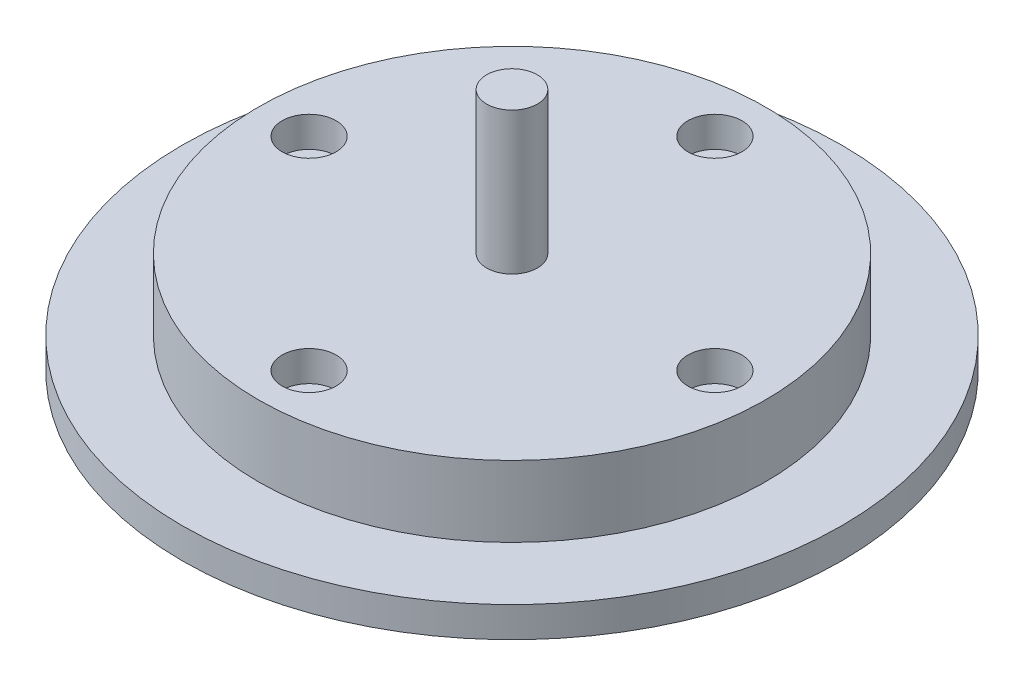
from build123d import *

# Parameters (mm, degrees)
SKETCH1_R           = 25
SKETCH1_R_2         = 1.5
BOSS_EXTRUDE1_DEPTH = 7
CUT_EXTRUDE1_START  = -3
SKETCH2_R           = 2.66
SKETCH2_R_2         = 1.5
CUT_EXTRUDE1_DEPTH  = 3
BOSS_EXTRUDE2_START = -3
SKETCH3_R           = 32.5
SKETCH3_R_2         = 1.5
BOSS_EXTRUDE2_DEPTH = 3
SKETCH4_R           = 2.5
BOSS_EXTRUDE3_DEPTH = 14


with BuildPart() as part:
    # Sketch1 → Boss-Extrude1 (new body)
    with BuildSketch(Plane(origin=(0, 0, 0), x_dir=(1, 0, 0), z_dir=(0, 1, 0))):
        with Locations(Location((0, 0, 0), (0, 0, 270))):
            Circle(SKETCH1_R)
        with Locations(Location((0, 20, 0), (0, 0, 270))):
            Circle(SKETCH1_R_2, mode=Mode.SUBTRACT)
        with Locations(Location((20, 0, 0), (0, 0, 270))):
            Circle(SKETCH1_R_2, mode=Mode.SUBTRACT)
        with Locations(Location((0, -20, 0), (0, 0, 270))):
            Circle(SKETCH1_R_2, mode=Mode.SUBTRACT)
        with Locations(Location((-20, 0, 0), (0, 0, 270))):
            Circle(SKETCH1_R_2, mode=Mode.SUBTRACT)
    extrude(amount=BOSS_EXTRUDE1_DEPTH)

    # Sketch2 → Cut-Extrude1 (cut)
    # profile 1 of 4: a face of its own
    with BuildSketch(Plane(origin=(0, 7, 0), x_dir=(1, 0, 0), z_dir=(0, 1, 0)).offset(CUT_EXTRUDE1_START)):
        with Locations(Location((-20, 0, 0), (0, 0, 270))):
            Circle(SKETCH2_R)
        with Locations(Location((-20, 0, 0), (0, 0, 270))):
            Circle(SKETCH2_R_2, mode=Mode.SUBTRACT)
    # profile 2 of 4: a face of its own
    with BuildSketch(Plane(origin=(0, 7, 0), x_dir=(1, 0, 0), z_dir=(0, 1, 0)).offset(CUT_EXTRUDE1_START)):
        with Locations(Location((0, 20, 0), (0, 0, 270))):
            Circle(SKETCH2_R)
        with Locations(Location((0, 20, 0), (0, 0, 270))):
            Circle(SKETCH2_R_2, mode=Mode.SUBTRACT)
    # profile 3 of 4: a face of its own
    with BuildSketch(Plane(origin=(0, 7, 0), x_dir=(1, 0, 0), z_dir=(0, 1, 0)).offset(CUT_EXTRUDE1_START)):
        with Locations(Location((20, 0, 0), (0, 0, 270))):
            Circle(SKETCH2_R)
        with Locations(Location((20, 0, 0), (0, 0, 270))):
            Circle(SKETCH2_R_2, mode=Mode.SUBTRACT)
    # profile 4 of 4: a face of its own
    with BuildSketch(Plane(origin=(0, 7, 0), x_dir=(1, 0, 0), z_dir=(0, 1, 0)).offset(CUT_EXTRUDE1_START)):
        with Locations(Location((0, -20, 0), (0, 0, 270))):
            Circle(SKETCH2_R)
        with Locations(Location((0, -20, 0), (0, 0, 270))):
            Circle(SKETCH2_R_2, mode=Mode.SUBTRACT)
    extrude(amount=CUT_EXTRUDE1_DEPTH, mode=Mode.SUBTRACT)

    # Sketch3 → Boss-Extrude2 (add)
    with BuildSketch(Plane(origin=(0, 0, 0), x_dir=(1, 0, 0), z_dir=(0, 1, 0)).offset(BOSS_EXTRUDE2_START)):
        with Locations(Location((0, 0, 0), (0, 0, 270))):
            Circle(SKETCH3_R)
        with Locations(Location((0, 20, 0), (0, 0, 270))):
            Circle(SKETCH3_R_2, mode=Mode.SUBTRACT)
        with Locations(Location((-20, 0, 0), (0, 0, 270))):
            Circle(SKETCH3_R_2, mode=Mode.SUBTRACT)
        with Locations(Location((0, -20, 0), (0, 0, 270))):
            Circle(SKETCH3_R_2, mode=Mode.SUBTRACT)
        with Locations(Location((20, 0, 0), (0, 0, 270))):
            Circle(SKETCH3_R_2, mode=Mode.SUBTRACT)
    extrude(amount=BOSS_EXTRUDE2_DEPTH)

    # Sketch4 → Boss-Extrude3 (add)
    with BuildSketch(Plane(origin=(0, 7, 0), x_dir=(1, 0, 0), z_dir=(0, 1, 0))):
        with Locations(Location((0, 0, 0), (0, 0, 270))):
            Circle(SKETCH4_R)
    extrude(amount=BOSS_EXTRUDE3_DEPTH)


solid = part.part
